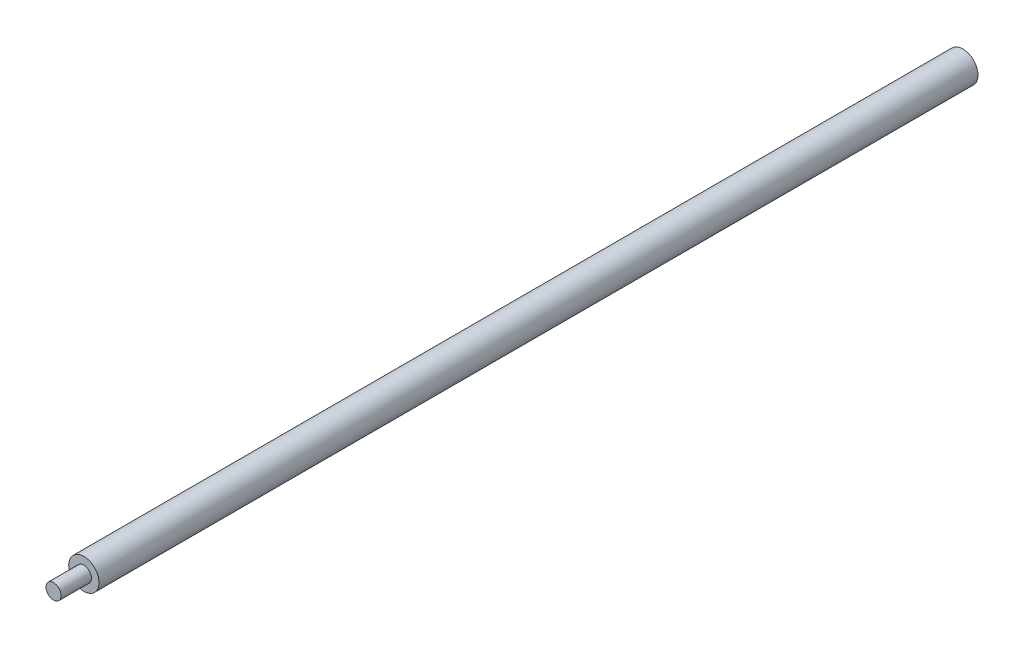
from build123d import *

# Parameters (mm, degrees)
SKETCH1_R           = 2.5
BOSS_EXTRUDE1_DEPTH = 145
SKETCH2_R           = 1.25
BOSS_EXTRUDE2_DEPTH = 5
SKETCH3_R           = 1.25
CUT_EXTRUDE1_DEPTH  = 5


with BuildPart() as part:
    # Sketch1 → Boss-Extrude1 (new body)
    with BuildSketch(Plane.XY):
        Circle(SKETCH1_R)
    extrude(amount=BOSS_EXTRUDE1_DEPTH)

    # Sketch2 → Boss-Extrude2 (add)
    with BuildSketch(Plane.XY.offset(145)):
        Circle(SKETCH2_R)
    extrude(amount=BOSS_EXTRUDE2_DEPTH)

    # Sketch3 → Cut-Extrude1 (cut)
    with BuildSketch(Plane(origin=(0, 0, 0), x_dir=(-1, 0, 0), z_dir=(0, 0, -1))):
        with Locations(Location((0, 0, 0), (0, 0, 180))):
            Circle(SKETCH3_R)
    extrude(amount=-CUT_EXTRUDE1_DEPTH, mode=Mode.SUBTRACT)


solid = part.part
